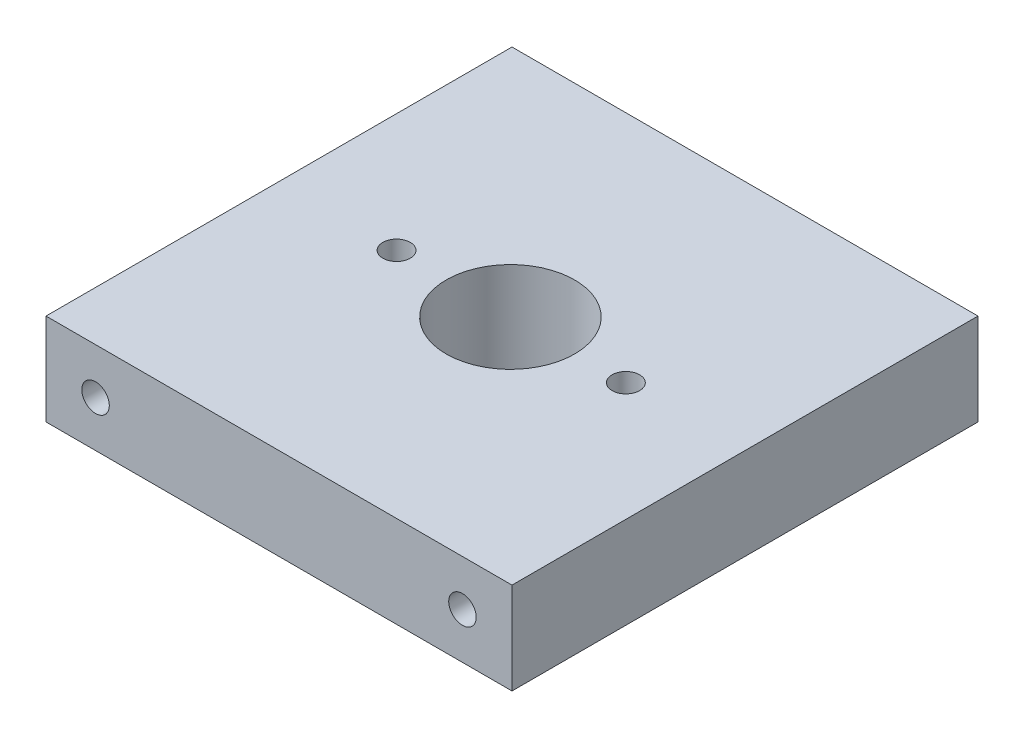
from build123d import *

# Parameters (mm, degrees)
SKETCH1_W           = 50.8
SKETCH1_H           = 50.8
BOSS_EXTRUDE1_DEPTH = 10
SKETCH2_R           = 7
SKETCH2_R_2         = 1.5
CUT_EXTRUDE1_DEPTH  = 38.286995052
SKETCH3_R           = 1.5
CUT_EXTRUDE2_DEPTH  = 58.669749436


with BuildPart() as part:
    # Sketch1 → Boss-Extrude1 (new body)
    with BuildSketch(Plane(origin=(0, 0, 0), x_dir=(1, 0, 0), z_dir=(0, 1, 0))):
        Rectangle(SKETCH1_W, SKETCH1_H)
    extrude(amount=BOSS_EXTRUDE1_DEPTH)

    # Sketch2 → Cut-Extrude1 (cut, through all)
    with BuildSketch(Plane(origin=(0, 10, 0), x_dir=(1, 0, 0), z_dir=(0, 1, 0))):
        with Locations(Location((0, -0.172221673, 0), (0, 0, 270))):
            Circle(SKETCH2_R)
        with Locations(Location((-12.5, -0.087466912, 0), (0, 0, 270))):
            Circle(SKETCH2_R_2)
        with Locations(Location((12.5, -0.087466912, 0), (0, 0, 90))):
            Circle(SKETCH2_R_2)
    extrude(amount=-CUT_EXTRUDE1_DEPTH, mode=Mode.SUBTRACT)

    # Sketch3 → Cut-Extrude2 (cut, through all)
    with BuildSketch(Plane(origin=(0, 0, -25.4), x_dir=(-1, 0, 0), z_dir=(0, 0, -1))):
        with Locations((20, 5)):
            Circle(SKETCH3_R)
        with Locations(Location((-20, 5, 0), (0, 0, 180))):
            Circle(SKETCH3_R)
    extrude(amount=-CUT_EXTRUDE2_DEPTH, mode=Mode.SUBTRACT)


solid = part.part
